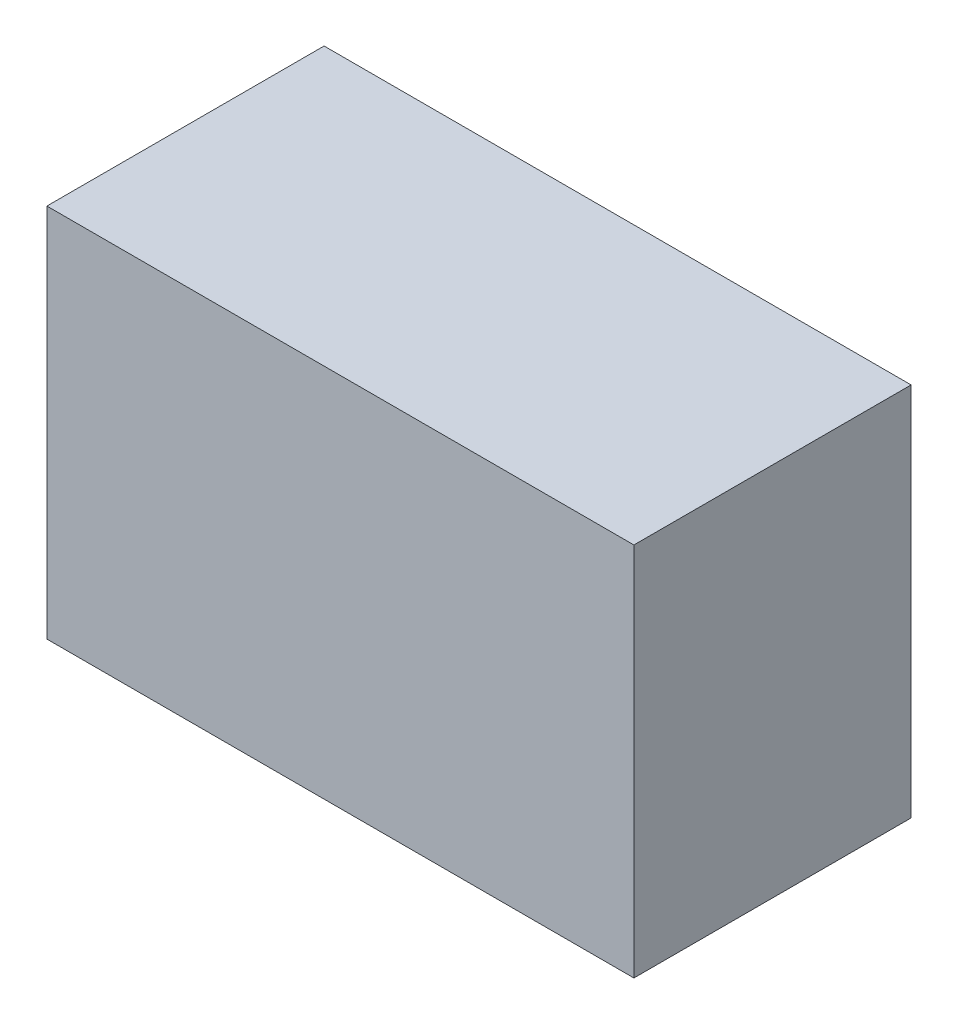
from build123d import *

# Parameters (mm, degrees)
SKETCH_1_W      = 72
SKETCH_1_H      = 34
EXTRUDE_1_DEPTH = 46


with BuildPart() as part:
    # 草图1 → 凸台-拉伸1 (new body)
    with BuildSketch(Plane(origin=(0, 0, 0), x_dir=(1, 0, 0), z_dir=(0, 1, 0))):
        Rectangle(SKETCH_1_W, SKETCH_1_H)
    extrude(amount=EXTRUDE_1_DEPTH)


solid = part.part
